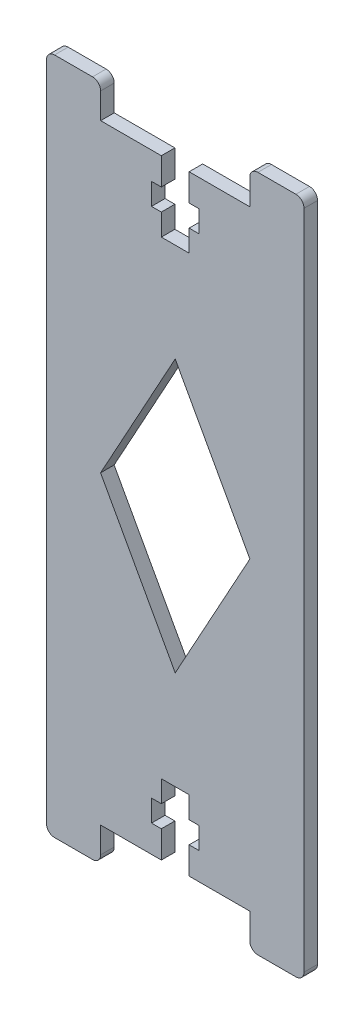
from build123d import *

# Parameters (mm, degrees)
EXTRUDE_1_DEPTH = 2
FILLET_1_R      = 1.2


with BuildPart() as part:
    # 草图1 → 凸台-拉伸1 (new body)
    with BuildSketch(Plane.XY):
        Polygon((15.059090909, 15.4), (15.059090909, -84.6), (7.059090909, -84.6), (7.059090909, -79.6), (-1.890909091, -79.6), (-1.890909091, -75.6), (-0.440909091, -75.6), (-0.440909091, -72.4), (-1.890909091, -72.4), (-1.890909091, -69.2), (-5.990909091, -69.2), (-5.990909091, -72.4), (-7.440909091, -72.4), (-7.440909091, -75.6), (-5.990909091, -75.6), (-5.990909091, -79.6), (-14.940909091, -79.6), (-14.940909091, -84.6), (-22.940909091, -84.6), (-22.940909091, 15.4), (-14.940909091, 15.4), (-14.940909091, 10.4), (-5.990909091, 10.4), (-5.990909091, 6.4), (-7.440909091, 6.4), (-7.440909091, 3.2), (-5.990909091, 3.2), (-5.990909091, 0), (-1.890909091, 0), (-1.890909091, 3.2), (-0.440909091, 3.2), (-0.440909091, 6.4), (-1.890909091, 6.4), (-1.890909091, 10.4), (7.059090909, 10.4), (7.059090909, 15.4), align=None)
        Polygon((-3.940909091, -14.542881477), (-14.954933713, -34.6), (-3.940909091, -54.657118523), (7.073115531, -34.6), align=None, mode=Mode.SUBTRACT)
    extrude(amount=EXTRUDE_1_DEPTH)

    # 圆角1
    fillet_1_edges = [part.edges().sort_by_distance(p)[0] for p in [
        (7.059090909, 15.4, 1),
        (15.059090909, 15.4, 1),
        (15.059090909, -84.6, 1),
        (7.059090909, -84.6, 1),
        (-14.940909091, -84.6, 1),
        (-22.940909091, -84.6, 1),
        (-22.940909091, 15.4, 1),
        (-14.940909091, 15.4, 1),
    ]]
    fillet(fillet_1_edges, radius=FILLET_1_R)


solid = part.part
